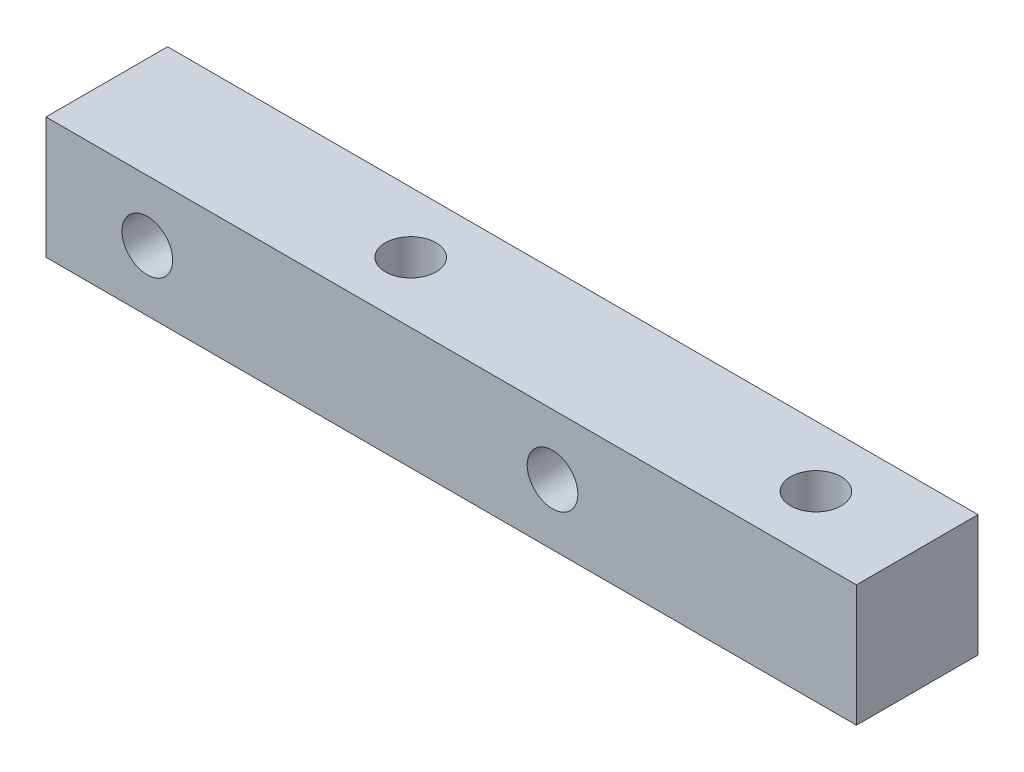
from build123d import *

# Parameters (mm, degrees)
SKETCH_1_W         = 40
SKETCH_1_H         = 6
EXTRUDE_1_DEPTH    = 3
HOLE_WIZARD_M3_1_D = 2.5
HOLE_WIZARD_M3_2_D = 2.5


with BuildPart() as part:
    # 草图1 → 凸台-拉伸1 (new, symmetric)
    with BuildSketch(Plane(origin=(0, 0, 0), x_dir=(1, 0, 0), z_dir=(0, 1, 0))):
        Rectangle(SKETCH_1_W, SKETCH_1_H)
    extrude(amount=EXTRUDE_1_DEPTH, both=True)

    # M3 螺纹孔1 (through all)
    with Locations(Plane(origin=(15, 3, 0), x_dir=(0, 0, 1), z_dir=(0, 1, 0))):
        with Locations((0, 0), (0, -20)):
            Hole(HOLE_WIZARD_M3_1_D / 2)

    # M3 螺纹孔2 (through all)
    with Locations(Plane(origin=(-15, 0, 3), x_dir=(1, 0, 0), z_dir=(0, 0, 1))):
        with Locations((0, 0), (20, 0)):
            Hole(HOLE_WIZARD_M3_2_D / 2)


solid = part.part
